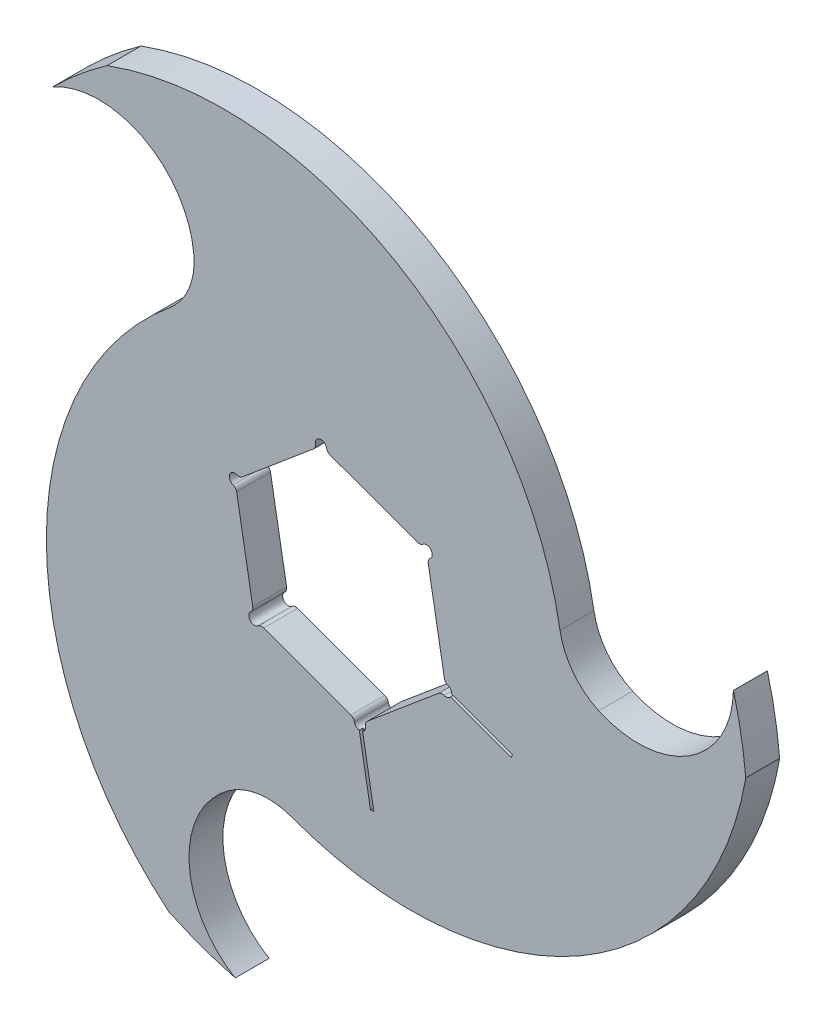
from build123d import *

# Parameters (mm, degrees)
BOSS_EXTRUDE1_DEPTH = 5
FILLET1_R           = 10
CUT_EXTRUDE1_DEPTH  = 0.5


with BuildPart() as part:
    # Sketch1 → Boss-Extrude1 (new body)
    with BuildSketch(Plane.XY):
        with BuildLine():
            ThreePointArc((32.82300848, 7.156370874), (9.466254973, 44.595523799), (-34.426436475, 49.140822863))
            ThreePointArc((-34.426436475, 49.140822863), (-38.572797774, 45.958016405), (-42.426406871, 42.426406871))
            ThreePointArc((-42.426406871, 42.426406871), (-26.29235792, 40.654943242), (-22.609103215, 24.847373735))
            ThreePointArc((-22.609103215, 24.847373735), (-43.353983992, -14.099744614), (-25.343982725, -54.38457998))
            ThreePointArc((-25.343982725, -54.38457998), (-20.514410827, -56.38403097), (-15.529142706, -57.955549577))
            ThreePointArc((-15.529142706, -57.955549577), (-22.062034677, -43.097321505), (-10.213905264, -32.003744609))
            ThreePointArc((-10.213905264, -32.003744609), (33.887729018, -30.495779185), (59.7704192, 5.243757117))
            ThreePointArc((59.7704192, 5.243757117), (59.087208601, 10.426014565), (57.955549577, 15.529142706))
            ThreePointArc((57.955549577, 15.529142706), (48.354392597, 2.442378263), (32.82300848, 7.156370874))
        make_face()
        with BuildLine():
            Line((-3.983032008, 15.390433913), (-14.46497239, 6.595041605))
            ThreePointArc((-14.46497239, 6.595041605), (-14.855921916, 6.412738847), (-15.285645517, 6.45033479))
            ThreePointArc((-15.285645517, 6.45033479), (-16.353739487, 5.952274392), (-15.855679089, 4.884180422))
            ThreePointArc((-15.855679089, 4.884180422), (-15.502325506, 4.63675958), (-15.320022748, 4.245810053))
            Line((-15.320022748, 4.245810053), (-12.943959764, -9.229512752))
            ThreePointArc((-12.943959764, -9.229512752), (-12.981555707, -9.659236353), (-13.22897655, -10.012589936))
            ThreePointArc((-13.22897655, -10.012589936), (-13.331690578, -11.186616647), (-12.157663867, -11.289330674))
            ThreePointArc((-12.157663867, -11.289330674), (-11.76671434, -11.107027916), (-11.336990739, -11.14462386))
            Line((-11.336990739, -11.14462386), (1.521012626, -15.824554357))
            ThreePointArc((1.521012626, -15.824554357), (1.874366209, -16.071975199), (2.056668967, -16.462924726))
            ThreePointArc((2.056668967, -16.462924726), (3.02204891, -17.138891039), (3.698015222, -16.173511097))
            ThreePointArc((3.698015222, -16.173511097), (3.735611166, -15.743787496), (3.983032008, -15.390433913))
            Line((3.983032008, -15.390433913), (14.46497239, -6.595041605))
            ThreePointArc((14.46497239, -6.595041605), (14.855921916, -6.412738847), (15.285645517, -6.45033479))
            ThreePointArc((15.285645517, -6.45033479), (16.353739487, -5.952274392), (15.855679089, -4.884180422))
            ThreePointArc((15.855679089, -4.884180422), (15.502325506, -4.63675958), (15.320022748, -4.245810053))
            Line((15.320022748, -4.245810053), (12.943959764, 9.229512752))
            ThreePointArc((12.943959764, 9.229512752), (12.981555707, 9.659236353), (13.22897655, 10.012589936))
            ThreePointArc((13.22897655, 10.012589936), (13.331690578, 11.186616647), (12.157663867, 11.289330674))
            ThreePointArc((12.157663867, 11.289330674), (11.76671434, 11.107027916), (11.336990739, 11.14462386))
            Line((11.336990739, 11.14462386), (-1.521012626, 15.824554357))
            ThreePointArc((-1.521012626, 15.824554357), (-1.874366209, 16.071975199), (-2.056668967, 16.462924726))
            ThreePointArc((-2.056668967, 16.462924726), (-3.02204891, 17.138891039), (-3.698015222, 16.173511097))
            ThreePointArc((-3.698015222, 16.173511097), (-3.735611166, 15.743787496), (-3.983032008, 15.390433913))
        make_face(mode=Mode.SUBTRACT)
    extrude(amount=BOSS_EXTRUDE1_DEPTH)

    # Fillet1
    fillet1_edges = [part.edges().sort_by_distance(p)[0] for p in [
        (32.82300848, 7.156370874, 2.5),
        (-10.213905264, -32.003744609, 2.5),
        (-22.609103215, 24.847373735, 2.5),
    ]]
    fillet(fillet1_edges, radius=FILLET1_R)

    # Sketch2 → Cut-Extrude1 (cut)
    with BuildSketch(Plane.XY.offset(5)):
        Polygon((2.689022882, -16.689899207), (3.181426759, -16.603075118), (4.917908536, -26.451152648), (4.425504659, -26.537976737), align=None)
        Polygon((15.798388141, -6.016187476), (15.969398213, -5.546341165), (25.36632442, -8.966542599), (25.195314349, -9.436388909), align=None)
    extrude(amount=-CUT_EXTRUDE1_DEPTH, mode=Mode.SUBTRACT)


solid = part.part
